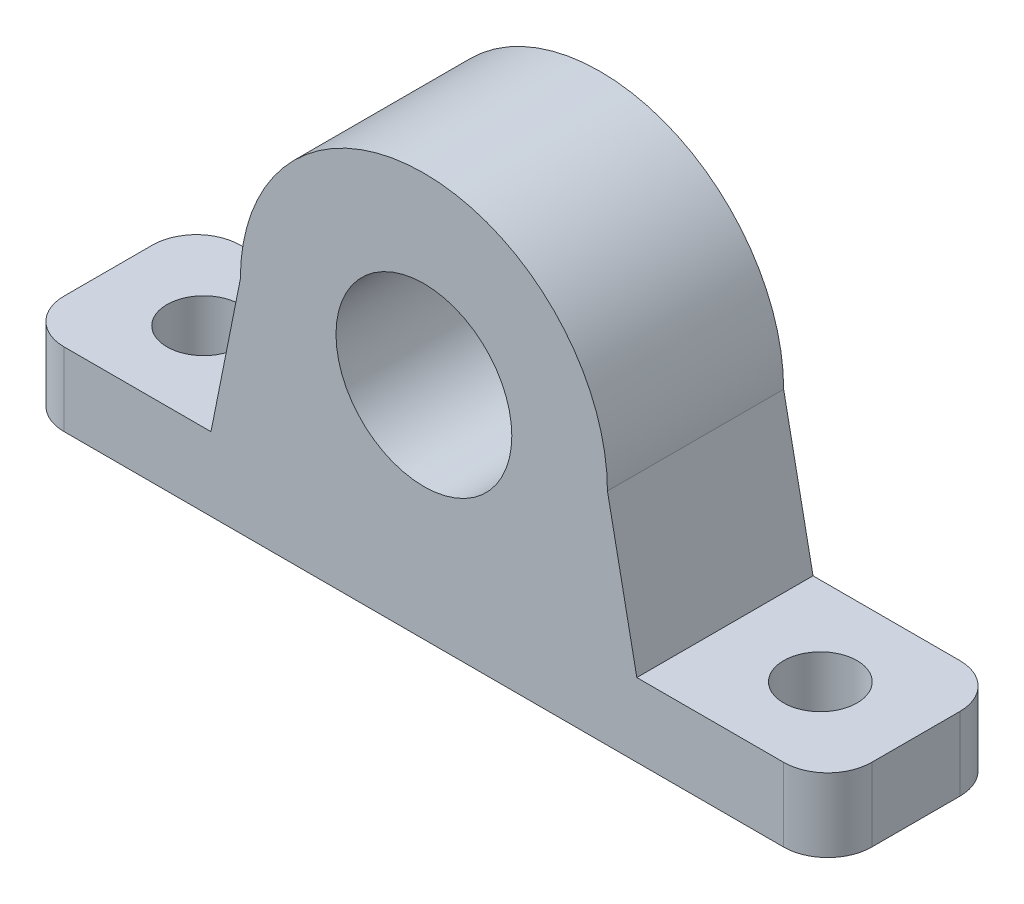
from build123d import *

# Parameters (mm, degrees)
BOSS_EXTRUDE3_DEPTH = 12
SKETCH7_R           = 5.987031074
CUT_EXTRUDE1_DEPTH  = 12
SKETCH9_R           = 2.5
CUT_EXTRUDE2_DEPTH  = 5
FILLET2_R           = 3


with BuildPart() as part:
    # Sketch5 → Boss-Extrude3 (new body)
    with BuildSketch(Plane.XY):
        with BuildLine():
            Line((0, 0), (55, 0))
            Line((55, 0), (55, 5))
            Line((55, 5), (42, 5))
            Line((42, 5), (40, 15))
            ThreePointArc((40, 15), (27.5, 27.5), (15, 15))
            Line((15, 15), (13, 5))
            Line((13, 5), (0, 5))
            Line((0, 5), (0, 0))
        make_face()
    extrude(amount=BOSS_EXTRUDE3_DEPTH)

    # Sketch7 → Cut-Extrude1 (cut)
    with BuildSketch(Plane(origin=(0, 0, 0), x_dir=(-1, 0, 0), z_dir=(0, 0, -1))):
        with Locations((-27.5, 15)):
            Circle(SKETCH7_R)
    extrude(amount=-CUT_EXTRUDE1_DEPTH, mode=Mode.SUBTRACT)

    # Sketch9 → Cut-Extrude2 (cut)
    with BuildSketch(Plane(origin=(0, 0, 0), x_dir=(1, 0, 0), z_dir=(0, 1, 0))):
        with Locations(Location((6.5, -6, 0), (0, 0, 90))):
            Circle(SKETCH9_R)
        with Locations(Location((48.5, -6, 0), (0, 0, 90))):
            Circle(SKETCH9_R)
    extrude(amount=CUT_EXTRUDE2_DEPTH, mode=Mode.SUBTRACT)

    # Fillet2
    fillet2_edges = [part.edges().sort_by_distance(p)[0] for p in [
        (0, 2.5, 0),
        (0, 2.5, 12),
        (55, 2.5, 12),
        (55, 2.5, 0),
    ]]
    fillet(fillet2_edges, radius=FILLET2_R)


solid = part.part
